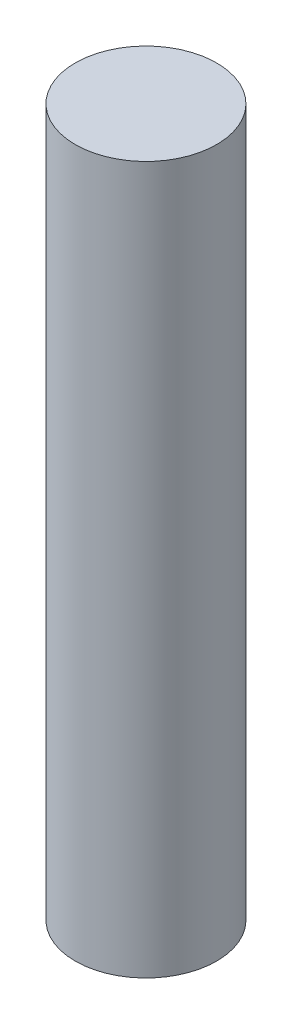
from build123d import *

# Parameters (mm, degrees)
SKETCH1_R           = 1
BOSS_EXTRUDE1_DEPTH = 10
SCALE1_SCALE        = 6


with BuildPart() as part:
    # Sketch1 → Boss-Extrude1 (new body)
    with BuildSketch(Plane(origin=(0, 0, 0), x_dir=(1, 0, 0), z_dir=(0, 1, 0))):
        with Locations(Location((0, 0, 0), (0, 0, 270))):
            Circle(SKETCH1_R)
    extrude(amount=BOSS_EXTRUDE1_DEPTH)


with BuildPart() as part_1:
    # Scale1: scaled about (0, 5, 0)
    add(part.part.scale(SCALE1_SCALE).moved(Location((0, -25, 0))))


solid = part_1.part
